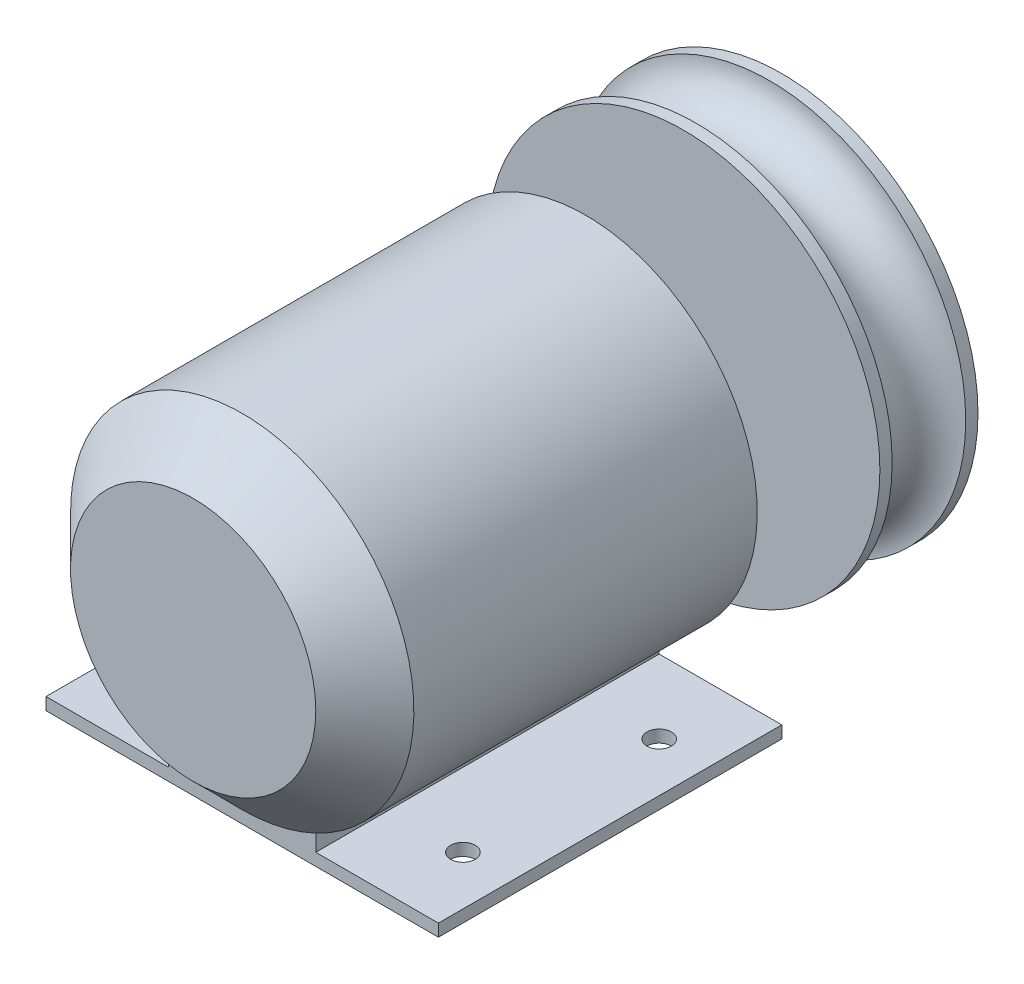
from build123d import *

# Parameters (mm, degrees)
SKETCH1_R           = 44.45
BOSS_EXTRUDE1_DEPTH = 101.6
CHAMFER1_SIZE       = 12.7
SKETCH2_R           = 3.175
BOSS_EXTRUDE2_DEPTH = 25.4
SKETCH4_R           = 44.45
CUT_EXTRUDE1_DEPTH  = 3.175
SKETCH5_W           = 101.6
SKETCH5_H           = 3.175
BOSS_EXTRUDE4_DEPTH = 88.9
SKETCH6_W           = 38.1
SKETCH6_H           = 7.01009255
BOSS_EXTRUDE5_DEPTH = 88.9
SKETCH7_R           = 3.175
CUT_EXTRUDE2_DEPTH  = 88.9
SKETCH8_R           = 3.175
CUT_EXTRUDE3_DEPTH  = 88.9


with BuildPart() as part:
    # Sketch1 → Boss-Extrude1 (new body)
    with BuildSketch(Plane.XY):
        Circle(SKETCH1_R)
    extrude(amount=BOSS_EXTRUDE1_DEPTH)

    # Chamfer1
    chamfer1_edges = [part.edges().sort_by_distance(p)[0] for p in [
        (-44.45, 0, 101.6),
    ]]
    chamfer(chamfer1_edges, length=CHAMFER1_SIZE)

    # Sketch2 → Boss-Extrude2 (add)
    with BuildSketch(Plane(origin=(0, 0, 0), x_dir=(-1, 0, 0), z_dir=(0, 0, -1))):
        with Locations(Location((0, 0, 0), (0, 0, 180))):
            Circle(SKETCH2_R)
    extrude(amount=BOSS_EXTRUDE2_DEPTH)

    # Sketch3 → Revolve2 (revolve)
    with BuildSketch(Plane(origin=(0, 0, 0), x_dir=(0, 0, -1), z_dir=(1, 0, 0)), mode=Mode.PRIVATE) as revolve2_sk:
        with BuildLine():
            Line((25.4, 0), (50.8, 0))
            Line((50.8, 0), (50.8, 50.8))
            Line((50.8, 50.8), (47.625, 50.8))
            ThreePointArc((47.625, 50.8), (38.1, 41.275), (28.575, 50.8))
            Line((28.575, 50.8), (25.4, 50.8))
            Line((25.4, 50.8), (25.4, 0))
        make_face()
    revolve(revolve2_sk.sketch.rotate(Axis((0, 0, -25.4), (0, 0, -1)), 90), axis=Axis((0, 0, -25.4), (0, 0, -1)))

    # Sketch4 → Cut-Extrude1 (cut)
    with BuildSketch(Plane(origin=(0, 0, -50.8), x_dir=(-1, 0, 0), z_dir=(0, 0, -1))):
        Circle(SKETCH4_R)
    extrude(amount=-CUT_EXTRUDE1_DEPTH, mode=Mode.SUBTRACT)



with BuildPart() as body_2:
    # Sketch5 → Boss-Extrude4 (new body)
    with BuildSketch(Plane.XY):
        with Locations((0, -46.0375)):
            Rectangle(SKETCH5_W, SKETCH5_H)
    extrude(amount=BOSS_EXTRUDE4_DEPTH)


with BuildPart() as part_1:
    add(part.part)

    add(body_2.part)  # Boss-Extrude5 merges body 2
    # Sketch6 → Boss-Extrude5 (add)
    with BuildSketch(Plane.XY.offset(88.9)):
        with Locations((0, -40.944953725)):
            Rectangle(SKETCH6_W, SKETCH6_H)
    extrude(amount=-BOSS_EXTRUDE5_DEPTH)

    # Sketch7 → Cut-Extrude2 (cut)
    with BuildSketch(Plane(origin=(0, -44.45, 0), x_dir=(1, 0, 0), z_dir=(0, 1, 0))):
        with Locations(Location((38.1, -19.05, 0), (0, 0, 180))):
            Circle(SKETCH7_R)
        with Locations(Location((38.1, -69.85, 0), (0, 0, 180))):
            Circle(SKETCH7_R)
    extrude(amount=-CUT_EXTRUDE2_DEPTH, mode=Mode.SUBTRACT)

    # Sketch8 → Cut-Extrude3 (cut)
    with BuildSketch(Plane(origin=(0, -44.45, 0), x_dir=(1, 0, 0), z_dir=(0, 1, 0))):
        with Locations(Location((-38.1, -19.05, 0), (0, 0, 180))):
            Circle(SKETCH8_R)
        with Locations(Location((-38.1, -69.85, 0), (0, 0, 180))):
            Circle(SKETCH8_R)
    extrude(amount=-CUT_EXTRUDE3_DEPTH, mode=Mode.SUBTRACT)


solid = part_1.part
